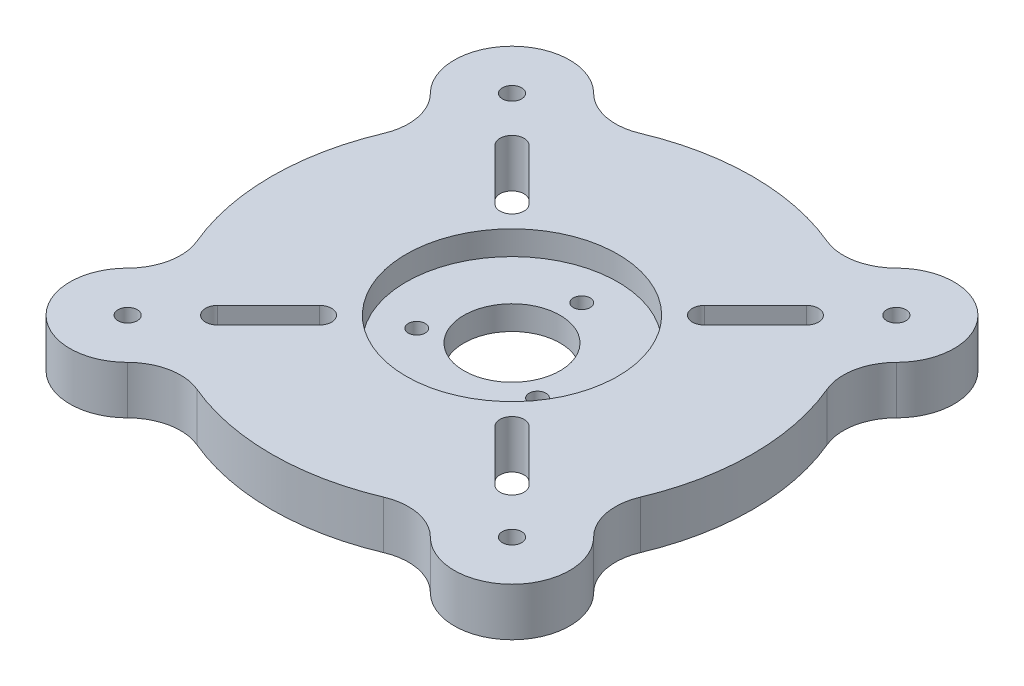
from build123d import *

# Parameters (mm, degrees)
SKETCH_1_R          = 2
EXTRUDE_1_DEPTH     = 10
SKETCH_2_R          = 22
SKETCH_2_R_2        = 10
CUT_EXTRUDE_1_DEPTH = 5
SKETCH_2_3_R        = 1.75
SKETCH_2_3_R_2      = 10
CUT_EXTRUDE_2_DEPTH = 75.1479844


with BuildPart() as part:
    # 草图1 → 凸台-拉伸1 (new body)
    with BuildSketch(Plane(origin=(0, 0, 0), x_dir=(1, 0, 0), z_dir=(0, 1, 0))):
        with BuildLine():
            ThreePointArc((46.077281732, -19.413503243), (50, 0), (46.077281732, 19.413503243))
            ThreePointArc((46.077281732, 19.413503243), (45.41900176, 25.799706685), (48.436814511, 31.466251763))
            ThreePointArc((48.436814511, 31.466251763), (48.436814511, 48.436814511), (31.466251763, 48.436814511))
            ThreePointArc((31.466251763, 48.436814511), (25.799706685, 45.41900176), (19.413503243, 46.077281732))
            ThreePointArc((19.413503243, 46.077281732), (0, 50), (-19.413503243, 46.077281732))
            ThreePointArc((-19.413503243, 46.077281732), (-25.799706685, 45.41900176), (-31.466251763, 48.436814511))
            ThreePointArc((-31.466251763, 48.436814511), (-48.436814511, 48.436814511), (-48.436814511, 31.466251763))
            ThreePointArc((-48.436814511, 31.466251763), (-45.41900176, 25.799706685), (-46.077281732, 19.413503243))
            ThreePointArc((-46.077281732, 19.413503243), (-50, 0), (-46.077281732, -19.413503243))
            ThreePointArc((-46.077281732, -19.413503243), (-45.41900176, -25.799706685), (-48.436814511, -31.466251763))
            ThreePointArc((-48.436814511, -31.466251763), (-48.436814511, -48.436814511), (-31.466251763, -48.436814511))
            ThreePointArc((-31.466251763, -48.436814511), (-25.799706685, -45.41900176), (-19.413503243, -46.077281732))
            ThreePointArc((-19.413503243, -46.077281732), (0, -50), (19.413503243, -46.077281732))
            ThreePointArc((19.413503243, -46.077281732), (25.799706685, -45.41900176), (31.466251763, -48.436814511))
            ThreePointArc((31.466251763, -48.436814511), (48.436814511, -48.436814511), (48.436814511, -31.466251763))
            ThreePointArc((48.436814511, -31.466251763), (45.41900176, -25.799706685), (46.077281732, -19.413503243))
        make_face()
        with BuildLine():
            ThreePointArc((-21.767766953, -18.232233047), (-18.232233047, -18.232233047), (-18.232233047, -21.767766953))
            Line((-18.232233047, -21.767766953), (-28.838834765, -32.374368671))
            ThreePointArc((-28.838834765, -32.374368671), (-32.374368671, -32.374368671), (-32.374368671, -28.838834765))
            Line((-32.374368671, -28.838834765), (-21.767766953, -18.232233047))
        make_face(mode=Mode.SUBTRACT)
        with BuildLine():
            ThreePointArc((18.232233047, -21.767766953), (18.232233047, -18.232233047), (21.767766953, -18.232233047))
            Line((21.767766953, -18.232233047), (32.374368671, -28.838834765))
            ThreePointArc((32.374368671, -28.838834765), (32.374368671, -32.374368671), (28.838834765, -32.374368671))
            Line((28.838834765, -32.374368671), (18.232233047, -21.767766953))
        make_face(mode=Mode.SUBTRACT)
        with BuildLine():
            ThreePointArc((-18.232233047, 21.767766953), (-18.232233047, 18.232233047), (-21.767766953, 18.232233047))
            Line((-21.767766953, 18.232233047), (-32.374368671, 28.838834765))
            ThreePointArc((-32.374368671, 28.838834765), (-32.374368671, 32.374368671), (-28.838834765, 32.374368671))
            Line((-28.838834765, 32.374368671), (-18.232233047, 21.767766953))
        make_face(mode=Mode.SUBTRACT)
        with BuildLine():
            ThreePointArc((21.767766953, 18.232233047), (18.232233047, 18.232233047), (18.232233047, 21.767766953))
            Line((18.232233047, 21.767766953), (28.838834765, 32.374368671))
            ThreePointArc((28.838834765, 32.374368671), (32.374368671, 32.374368671), (32.374368671, 28.838834765))
            Line((32.374368671, 28.838834765), (21.767766953, 18.232233047))
        make_face(mode=Mode.SUBTRACT)
        with Locations((39.951533137, -39.951533137)):
            Circle(SKETCH_1_R, mode=Mode.SUBTRACT)
        with Locations((-39.951533137, -39.951533137)):
            Circle(SKETCH_1_R, mode=Mode.SUBTRACT)
        with Locations((-39.951533137, 39.951533137)):
            Circle(SKETCH_1_R, mode=Mode.SUBTRACT)
        with Locations((39.951533137, 39.951533137)):
            Circle(SKETCH_1_R, mode=Mode.SUBTRACT)
    extrude(amount=EXTRUDE_1_DEPTH)

    # 草图2 → 切除-拉伸1 (cut)
    with BuildSketch(Plane(origin=(0, 10, 0), x_dir=(1, 0, 0), z_dir=(0, 1, 0))):
        Circle(SKETCH_2_R)
        Circle(SKETCH_2_R_2, mode=Mode.SUBTRACT)
    extrude(amount=-CUT_EXTRUDE_1_DEPTH, mode=Mode.SUBTRACT)

    # 草图2<3> → 切除-拉伸2 (cut, through all)
    with BuildSketch(Plane(origin=(0, 10, 0), x_dir=(1, 0, 0), z_dir=(0, 1, 0))):
        with Locations((0, 14.5)):
            Circle(SKETCH_2_3_R)
        with Locations((12.557368355, -7.25)):
            Circle(SKETCH_2_3_R)
        with Locations((-12.557368355, -7.25)):
            Circle(SKETCH_2_3_R)
        Circle(SKETCH_2_3_R_2)
    extrude(amount=-CUT_EXTRUDE_2_DEPTH, mode=Mode.SUBTRACT)


solid = part.part
